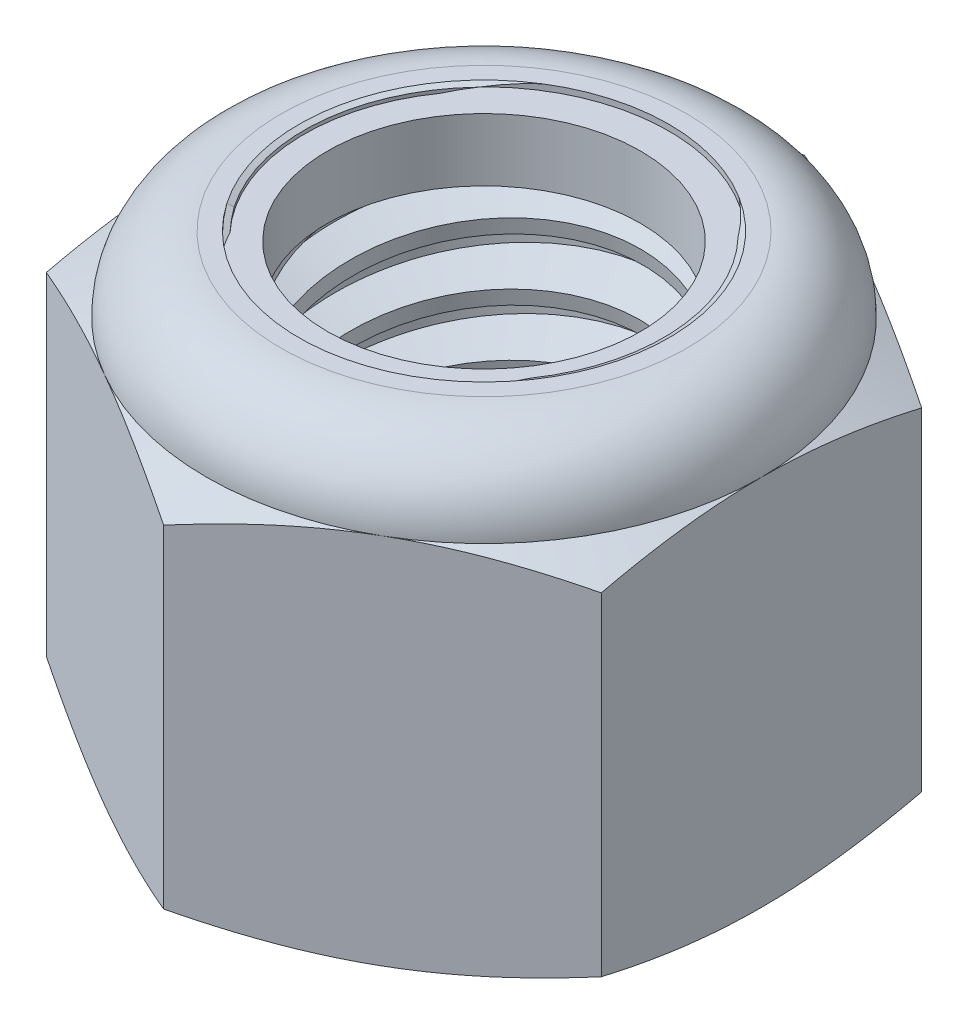
from build123d import *

# Parameters (mm, degrees)
EXTRUDE1_DEPTH      = 11.509375
SKETCH2_W           = 4.7625
SKETCH2_H           = 11.509375
LPATTERN1_COUNT     = 7
LPATTERN1_PITCH     = 1.5875
LPATTERN1_COL_COUNT = 2
LPATTERN1_COL_PITCH = 1.5875


with BuildPart() as part:
    # Sketch1 → Extrude1 (new body)
    with BuildSketch(Plane(origin=(0, 0, 0), x_dir=(1, 0, 0), z_dir=(0, 1, 0))):
        Polygon((0, 8.248891971), (-7.14375, 4.124445986), (-7.14375, -4.124445986), (0, -8.248891971), (7.14375, -4.124445986), (7.14375, 4.124445986), align=None)
    extrude(amount=EXTRUDE1_DEPTH)

    # Sketch4 → Cut-Revolve2 (revolve, cut)
    with BuildSketch(Plane(origin=(0, 0, 0), x_dir=(0, 0, -1), z_dir=(1, 0, 0)), mode=Mode.PRIVATE) as cut_revolve2_sk:
        Polygon((0, 11.509375), (4.7625, 11.509375), (4.029111805, 11.167390468), (4.029111805, 0.341984532), (4.7625, 0), (0, 0), align=None)
    revolve(cut_revolve2_sk.sketch.rotate(Axis((0, 11.509375, 0), (0, 1, 0)), 55.157981045), axis=Axis((0, 11.509375, 0), (0, 1, 0)), mode=Mode.SUBTRACT)


with BuildPart() as body_2:
    # Sketch2 → Revolve1 (revolve)
    with BuildSketch(Plane(origin=(0, 0, 0), x_dir=(0, 0, -1), z_dir=(1, 0, 0))):
        with Locations((2.38125, 5.7546875)):
            Rectangle(SKETCH2_W, SKETCH2_H)
    revolve(axis=Axis((0, -4.7625, 0), (0, 1, 0)))

    # Sketch3 → Cut-Revolve1 (revolve, cut)
    with BuildSketch(Plane(origin=(0, 0, 0), x_dir=(0, 0, -1), z_dir=(1, 0, 0)), mode=Mode.PRIVATE) as cut_revolve1_sk:
        Polygon((4.795122924, 11.313637456), (5.023483392, 9.943474646), (4.094357653, 10.291557102), (4.029111805, 10.68303219), align=None)
    cut_revolve1 = revolve(cut_revolve1_sk.sketch.rotate(Axis((0, 11.509375, 0.28317269), (0, -0.9863939238321436, -0.16439898730535765)), 180), axis=Axis((0, 11.509375, 0.28317269), (0, -0.9863939238321436, -0.16439898730535765)), mode=Mode.SUBTRACT)

    # LPattern1: Cut-Revolve1 ×7
    with Locations(*[(0, -i * LPATTERN1_PITCH, 0) for i in range(1, LPATTERN1_COUNT)]):
        add(cut_revolve1, mode=Mode.SUBTRACT)

    # LPattern1 col: Cut-Revolve1 ×2
    with Locations(*[(0, i * LPATTERN1_COL_PITCH, 0) for i in range(1, LPATTERN1_COL_COUNT)]):
        add(cut_revolve1, mode=Mode.SUBTRACT)


with BuildPart() as part_1:
    add(part.part)

    # Combine1: cut body 2
    add(body_2.part, mode=Mode.SUBTRACT)

    # Sketch5 → Cut-Revolve3 (revolve, cut)
    with BuildSketch(Plane(origin=(0, 0, 0), x_dir=(0, 0, -1), z_dir=(1, 0, 0)), mode=Mode.PRIVATE) as cut_revolve3_sk:
        with BuildLine():
            Line((0, 0), (7.14375, 0))
            Line((7.14375, 0), (8.248891971, 0.515336164))
            Line((8.248891971, 0.515336164), (8.248891971, 9.075809669))
            Line((8.248891971, 9.075809669), (7.14375, 9.591145833))
            ThreePointArc((7.14375, 9.591145833), (6.581913685, 10.947538685), (5.225520833, 11.509375))
            Line((5.225520833, 11.509375), (5.225520833, 12.779375))
            Line((5.225520833, 12.779375), (9.518891971, 12.779375))
            Line((9.518891971, 12.779375), (9.518891971, -1.27))
            Line((9.518891971, -1.27), (0, -1.27))
            Line((0, -1.27), (0, 0))
        make_face()
    revolve(cut_revolve3_sk.sketch.rotate(Axis((0, 0, 0), (0, 1, 0)), 55.157981045), axis=Axis((0, 0, 0), (0, 1, 0)), mode=Mode.SUBTRACT)

    # Sketch6 → Cut-Revolve4 (revolve, cut)
    with BuildSketch(Plane(origin=(0, 0, 0), x_dir=(0, 0, -1), z_dir=(1, 0, 0)), mode=Mode.PRIVATE) as cut_revolve4_sk:
        with BuildLine():
            Line((0, 9.591145833), (6.99135, 9.591145833))
            ThreePointArc((6.99135, 9.591145833), (6.474150612, 10.839775612), (5.225520833, 11.356975))
            Line((5.225520833, 11.356975), (4.627316319, 11.356975))
            Line((4.627316319, 11.356975), (4.627316319, 12.779375))
            Line((4.627316319, 12.779375), (0, 12.779375))
            Line((0, 12.779375), (0, 9.591145833))
        make_face()
    revolve(cut_revolve4_sk.sketch.rotate(Axis((0, 12.779375, 0), (0, 1, 0)), 55.157981045), axis=Axis((0, 12.779375, 0), (0, 1, 0)), mode=Mode.SUBTRACT)


with BuildPart() as body_2_2:
    # Sketch7 → Revolve2 (revolve)
    with BuildSketch(Plane(origin=(0, 0, 0), x_dir=(0, 0, -1), z_dir=(1, 0, 0)), mode=Mode.PRIVATE) as revolve2_sk:
        with BuildLine():
            Line((4.029111805, 9.667345833), (6.913430867, 9.667345833))
            ThreePointArc((6.913430867, 9.667345833), (6.39301751, 10.812537757), (5.225520833, 11.280775))
            Line((5.225520833, 11.280775), (4.029111805, 11.280775))
            Line((4.029111805, 11.280775), (4.029111805, 9.667345833))
        make_face()
    revolve(revolve2_sk.sketch.rotate(Axis((0, 9.667345833, 0), (0, 1, 0)), 55.157981045), axis=Axis((0, 9.667345833, 0), (0, 1, 0)))


solid = Compound([part_1.part, body_2_2.part])
